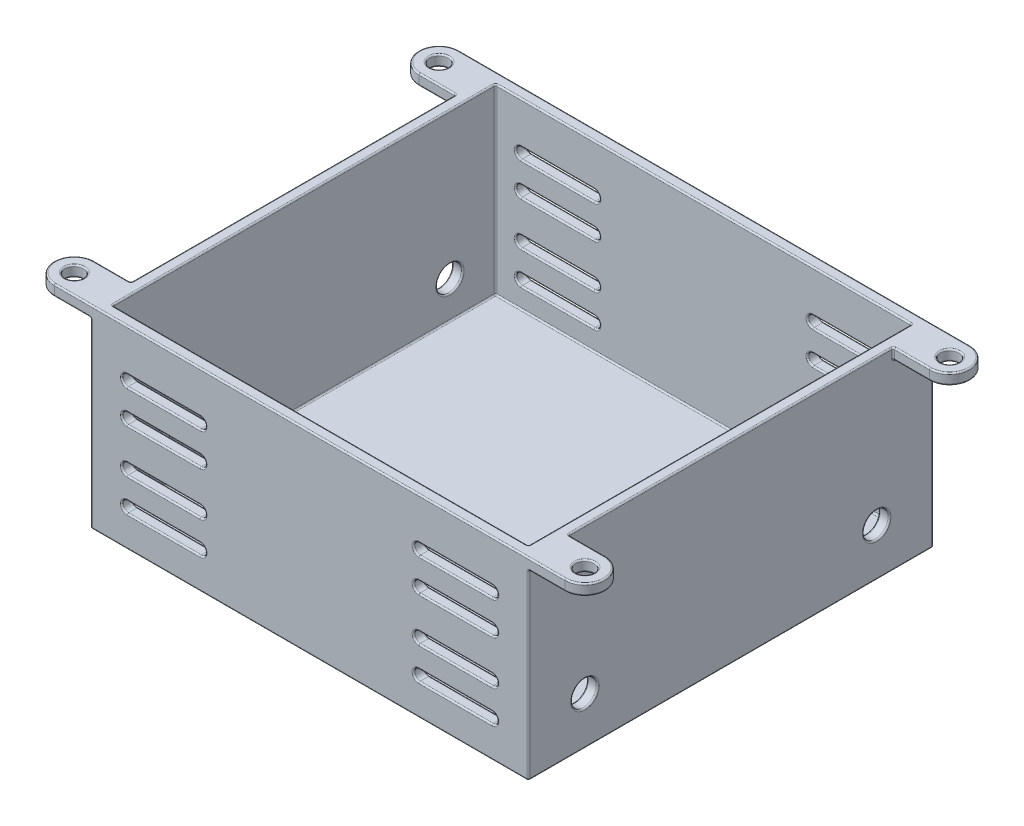
from build123d import *

# Parameters (mm, degrees)
SKETCH2_W               = 60
SKETCH2_H               = 55.5
SKETCH2_W_2             = 57
SKETCH2_H_2             = 52.5
BOSS_EXTRUDE1_DEPTH     = 25
SKETCH3_W               = 60
SKETCH3_H               = 55.5
BOSS_EXTRUDE2_DEPTH     = 1.5
SKETCH4_R               = 1.25
BOSS_EXTRUDE3_DEPTH     = 1.5
CUT_EXTRUDE4_DEPTH      = 53.5
CUT_EXTRUDE4_DEPTH_BACK = 34.5
SKETCH6_R               = 1.75
CUT_EXTRUDE5_DEPTH      = 73.5
FILLET1_R               = 0.2


with BuildPart() as part:
    # Sketch2 → Boss-Extrude1 (new body)
    with BuildSketch(Plane(origin=(0, 0, 0), x_dir=(1, 0, 0), z_dir=(0, 1, 0))):
        Rectangle(SKETCH2_W, SKETCH2_H)
        Rectangle(SKETCH2_W_2, SKETCH2_H_2, mode=Mode.SUBTRACT)
    extrude(amount=-BOSS_EXTRUDE1_DEPTH)

    # Sketch3 → Boss-Extrude2 (add)
    with BuildSketch(Plane.XZ.offset(25)):
        Rectangle(SKETCH3_W, SKETCH3_H)
    extrude(amount=BOSS_EXTRUDE2_DEPTH)

    # Sketch4 → Boss-Extrude3 (add)
    # profile 1 of 4: a face of its own
    with BuildSketch(Plane(origin=(0, 0, 0), x_dir=(1, 0, 0), z_dir=(0, 1, 0))):
        with BuildLine():
            Line((-30, 27.75), (-30, 22.25))
            Line((-30, 22.25), (-35, 22.25))
            ThreePointArc((-35, 22.25), (-37.75, 25), (-35, 27.75))
            Line((-35, 27.75), (-30, 27.75))
        make_face()
        with Locations(Location((-35, 25, 0), (0, 0, 270))):
            Circle(SKETCH4_R, mode=Mode.SUBTRACT)
    # profile 2 of 4: a face of its own
    with BuildSketch(Plane(origin=(0, 0, 0), x_dir=(1, 0, 0), z_dir=(0, 1, 0))):
        with BuildLine():
            Line((30, -27.75), (30, -22.25))
            Line((30, -22.25), (35, -22.25))
            ThreePointArc((35, -22.25), (37.75, -25), (35, -27.75))
            Line((35, -27.75), (30, -27.75))
        make_face()
        with Locations(Location((35, -25, 0), (0, 0, 270))):
            Circle(SKETCH4_R, mode=Mode.SUBTRACT)
    # profile 3 of 4: a face of its own
    with BuildSketch(Plane(origin=(0, 0, 0), x_dir=(1, 0, 0), z_dir=(0, 1, 0))):
        with BuildLine():
            Line((-35, -22.25), (-30, -22.25))
            Line((-30, -22.25), (-30, -27.75))
            Line((-30, -27.75), (-35, -27.75))
            ThreePointArc((-35, -27.75), (-37.75, -25), (-35, -22.25))
        make_face()
        with Locations(Location((-35, -25, 0), (0, 0, 270))):
            Circle(SKETCH4_R, mode=Mode.SUBTRACT)
    # profile 4 of 4: a face of its own
    with BuildSketch(Plane(origin=(0, 0, 0), x_dir=(1, 0, 0), z_dir=(0, 1, 0))):
        with BuildLine():
            Line((35, 22.25), (30, 22.25))
            Line((30, 22.25), (30, 27.75))
            Line((30, 27.75), (35, 27.75))
            ThreePointArc((35, 27.75), (37.75, 25), (35, 22.25))
        make_face()
        with Locations(Location((35, 25, 0), (0, 0, 270))):
            Circle(SKETCH4_R, mode=Mode.SUBTRACT)
    extrude(amount=-BOSS_EXTRUDE3_DEPTH)

    # Sketch5 → Cut-Extrude4 (cut, two sides: drawn at the far end of the back side and taken through both)
    with BuildSketch(Plane.XY.offset(-CUT_EXTRUDE4_DEPTH_BACK)):
        with BuildLine():
            Line((-25, -5.75), (-15, -5.75))
            ThreePointArc((-15, -5.75), (-14.25, -6.5), (-15, -7.25))
            Line((-15, -7.25), (-25, -7.25))
            ThreePointArc((-25, -7.25), (-25.75, -6.5), (-25, -5.75))
        make_face()
        with BuildLine():
            Line((-25, -10.25), (-15, -10.25))
            ThreePointArc((-15, -10.25), (-14.25, -11), (-15, -11.75))
            Line((-15, -11.75), (-25, -11.75))
            ThreePointArc((-25, -11.75), (-25.75, -11), (-25, -10.25))
        make_face()
        with BuildLine():
            Line((25, -5.75), (15, -5.75))
            ThreePointArc((15, -5.75), (14.25, -6.5), (15, -7.25))
            Line((15, -7.25), (25, -7.25))
            ThreePointArc((25, -7.25), (25.75, -6.5), (25, -5.75))
        make_face()
        with BuildLine():
            Line((25, -10.25), (15, -10.25))
            ThreePointArc((15, -10.25), (14.25, -11), (15, -11.75))
            Line((15, -11.75), (25, -11.75))
            ThreePointArc((25, -11.75), (25.75, -11), (25, -10.25))
        make_face()
        with BuildLine():
            Line((25, -17.75), (15, -17.75))
            ThreePointArc((15, -17.75), (14.25, -17), (15, -16.25))
            Line((15, -16.25), (25, -16.25))
            ThreePointArc((25, -16.25), (25.75, -17), (25, -17.75))
        make_face()
        with BuildLine():
            Line((-25, -17.75), (-15, -17.75))
            ThreePointArc((-15, -17.75), (-14.25, -17), (-15, -16.25))
            Line((-15, -16.25), (-25, -16.25))
            ThreePointArc((-25, -16.25), (-25.75, -17), (-25, -17.75))
        make_face()
        with BuildLine():
            Line((25, -22.25), (15, -22.25))
            ThreePointArc((15, -22.25), (14.25, -21.5), (15, -20.75))
            Line((15, -20.75), (25, -20.75))
            ThreePointArc((25, -20.75), (25.75, -21.5), (25, -22.25))
        make_face()
        with BuildLine():
            Line((-25, -22.25), (-15, -22.25))
            ThreePointArc((-15, -22.25), (-14.25, -21.5), (-15, -20.75))
            Line((-15, -20.75), (-25, -20.75))
            ThreePointArc((-25, -20.75), (-25.75, -21.5), (-25, -22.25))
        make_face()
    extrude(amount=CUT_EXTRUDE4_DEPTH + CUT_EXTRUDE4_DEPTH_BACK, mode=Mode.SUBTRACT)

    # Sketch6 → Cut-Extrude5 (cut)
    with BuildSketch(Plane(origin=(30, 0, 0), x_dir=(0, 0, -1), z_dir=(1, 0, 0))):
        with Locations(Location((-20, -20, 0), (0, 0, 180))):
            Circle(SKETCH6_R)
        with Locations(Location((20, -20, 0), (0, 0, 180))):
            Circle(SKETCH6_R)
    extrude(amount=-CUT_EXTRUDE5_DEPTH, mode=Mode.SUBTRACT)

    # Fillet1
    fillet1_edges = [part.edges().sort_by_distance(p)[0] for p in [
        (-20, -7.25, -26.25),
        (-14.25, -6.5, -26.25),
        (-20, -5.75, -26.25),
        (-25.75, -6.5, -26.25),
        (-20, -17.75, -26.25),
        (-14.25, -17, -26.25),
        (-20, -16.25, -26.25),
        (-25.75, -17, -26.25),
        (20, -20.75, -26.25),
        (14.25, -21.5, -26.25),
        (20, -22.25, -26.25),
        (25.75, -21.5, -26.25),
        (-20, -22.25, -26.25),
        (-14.25, -21.5, -26.25),
        (-20, -20.75, -26.25),
        (-25.75, -21.5, -26.25),
        (-20, -11.75, -26.25),
        (-14.25, -11, -26.25),
        (-20, -10.25, -26.25),
        (-25.75, -11, -26.25),
        (20, -5.75, -26.25),
        (14.25, -6.5, -26.25),
        (20, -7.25, -26.25),
        (25.75, -6.5, -26.25),
        (20, -10.25, -26.25),
        (14.25, -11, -26.25),
        (20, -11.75, -26.25),
        (25.75, -11, -26.25),
        (20, -16.25, -26.25),
        (14.25, -17, -26.25),
        (20, -17.75, -26.25),
        (25.75, -17, -26.25),
        (28.5, -25, 0),
        (28.5, -12.5, -26.25),
        (0, -25, 26.25),
        (28.5, -12.5, 26.25),
        (25.75, -17, -27.75),
        (-28.5, -25, 0),
        (25.75, -17, 27.75),
        (25.75, -17, 26.25),
        (20, -17.75, -27.75),
        (20, -17.75, 27.75),
        (20, -17.75, 26.25),
        (14.25, -17, -27.75),
        (14.25, -17, 27.75),
        (14.25, -17, 26.25),
        (-28.5, -12.5, 26.25),
        (20, -16.25, -27.75),
        (20, -16.25, 27.75),
        (20, -16.25, 26.25),
        (0, -25, -26.25),
        (-28.5, -12.5, -26.25),
        (28.5, 0, 0),
        (0, 0, -26.25),
        (-28.5, 0, 0),
        (25.75, -11, -27.75),
        (0, 0, 26.25),
        (25.75, -11, 27.75),
        (25.75, -11, 26.25),
        (20, -11.75, -27.75),
        (20, -11.75, 27.75),
        (20, -11.75, 26.25),
        (14.25, -11, -27.75),
        (14.25, -11, 27.75),
        (14.25, -11, 26.25),
        (20, -10.25, -27.75),
        (20, -10.25, 27.75),
        (20, -10.25, 26.25),
        (25.75, -6.5, -27.75),
        (25.75, -6.5, 27.75),
        (25.75, -6.5, 26.25),
        (20, -7.25, -27.75),
        (20, -7.25, 27.75),
        (20, -7.25, 26.25),
        (14.25, -6.5, -27.75),
        (14.25, -6.5, 27.75),
        (14.25, -6.5, 26.25),
        (20, -5.75, -27.75),
        (20, -5.75, 27.75),
        (20, -5.75, 26.25),
        (-25.75, -11, -27.75),
        (-25.75, -11, 27.75),
        (-25.75, -11, 26.25),
        (-20, -10.25, -27.75),
        (-20, -10.25, 27.75),
        (-20, -10.25, 26.25),
        (-14.25, -11, -27.75),
        (-14.25, -11, 27.75),
        (-14.25, -11, 26.25),
        (-20, -11.75, -27.75),
        (-20, -11.75, 27.75),
        (-20, -11.75, 26.25),
        (-25.75, -21.5, -27.75),
        (-25.75, -21.5, 27.75),
        (-25.75, -21.5, 26.25),
        (-20, -20.75, -27.75),
        (-20, -20.75, 27.75),
        (-20, -20.75, 26.25),
        (-14.25, -21.5, -27.75),
        (-14.25, -21.5, 27.75),
        (-14.25, -21.5, 26.25),
        (-20, -22.25, -27.75),
        (-20, -22.25, 27.75),
        (-20, -22.25, 26.25),
        (25.75, -21.5, -27.75),
        (25.75, -21.5, 27.75),
        (25.75, -21.5, 26.25),
        (20, -22.25, -27.75),
        (20, -22.25, 27.75),
        (20, -22.25, 26.25),
        (14.25, -21.5, -27.75),
        (14.25, -21.5, 27.75),
        (14.25, -21.5, 26.25),
        (20, -20.75, -27.75),
        (20, -20.75, 27.75),
        (20, -20.75, 26.25),
        (-25.75, -17, -27.75),
        (-25.75, -17, 27.75),
        (-25.75, -17, 26.25),
        (-20, -16.25, -27.75),
        (-20, -16.25, 27.75),
        (-20, -16.25, 26.25),
        (-14.25, -17, -27.75),
        (-14.25, -17, 27.75),
        (-14.25, -17, 26.25),
        (-20, -17.75, -27.75),
        (-20, -17.75, 27.75),
        (-20, -17.75, 26.25),
        (-25.75, -6.5, -27.75),
        (-25.75, -6.5, 27.75),
        (-25.75, -6.5, 26.25),
        (-20, -5.75, -27.75),
        (-20, -5.75, 27.75),
        (-20, -5.75, 26.25),
        (-14.25, -6.5, -27.75),
        (-14.25, -6.5, 27.75),
        (-14.25, -6.5, 26.25),
        (-20, -7.25, -27.75),
        (-20, -7.25, 27.75),
        (-20, -7.25, 26.25),
        (0, -26.5, 27.75),
        (-30, -26.5, 0),
        (0, -26.5, -27.75),
        (30, -26.5, 0),
        (-30, -20, 18.25),
        (28.5, -20, 18.25),
        (-28.5, -20, 18.25),
        (30, -20, 18.25),
        (-30, -20, -21.75),
        (28.5, -20, -21.75),
        (-28.5, -20, -21.75),
        (30, -20, -21.75),
        (-30, 0, 0),
        (-32.5, -1.5, -27.75),
        (-30, -1.5, -25),
        (-32.5, -1.5, -22.25),
        (-30, -0.75, -22.25),
        (-37.75, -1.5, -25),
        (-35, -1.5, -26.25),
        (-37.75, 0, -25),
        (-32.5, 0, -22.25),
        (-35, 0, -26.25),
        (0, 0, -27.75),
        (0, 0, 27.75),
        (-30, -1.5, 25),
        (-30, -0.75, 22.25),
        (-32.5, -1.5, 27.75),
        (-37.75, -1.5, 25),
        (-32.5, -1.5, 22.25),
        (-35, -1.5, 23.75),
        (-32.5, 0, 22.25),
        (-37.75, 0, 25),
        (-35, 0, 23.75),
        (30, 0, 0),
        (32.5, -1.5, 27.75),
        (30, -1.5, 25),
        (32.5, -1.5, 22.25),
        (30, -0.75, 22.25),
        (37.75, -1.5, 25),
        (35, -1.5, 23.75),
        (37.75, 0, 25),
        (32.5, 0, 22.25),
        (35, 0, 23.75),
        (-30, -14, -27.75),
        (30, -14, -27.75),
        (30, -14, 27.75),
        (-30, -14, 27.75),
        (32.5, -1.5, -27.75),
        (37.75, -1.5, -25),
        (32.5, -1.5, -22.25),
        (30, -1.5, -25),
        (30, -0.75, -22.25),
        (35, -1.5, -26.25),
        (32.5, 0, -22.25),
        (37.75, 0, -25),
        (35, 0, -26.25),
    ]]
    fillet(fillet1_edges, radius=FILLET1_R)


solid = part.part
